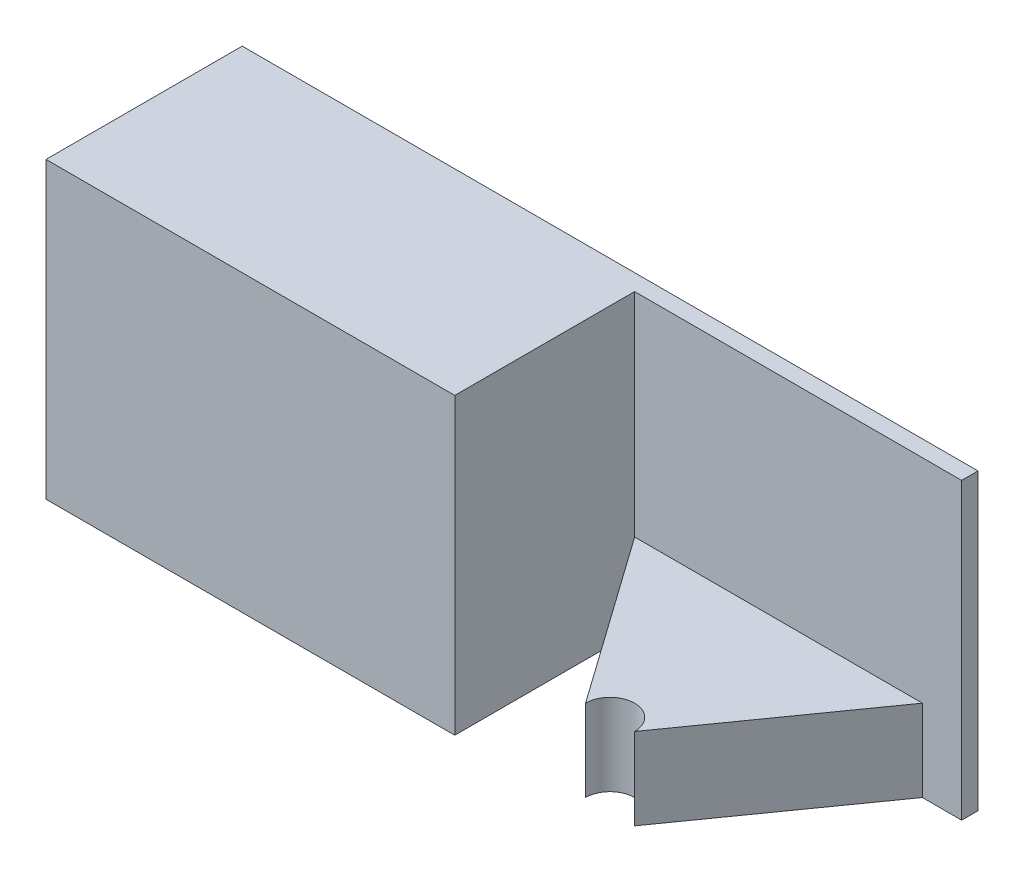
from build123d import *

# Parameters (mm, degrees)
SKETCH2_W           = 250
SKETCH2_H           = 120
BOSS_EXTRUDE1_DEPTH = 180
SKETCH3_W           = 450
SKETCH3_H           = 180
BOSS_EXTRUDE2_DEPTH = 10
BOSS_EXTRUDE3_DEPTH = 50


with BuildPart() as part:
    # Sketch2 → Boss-Extrude1 (new body)
    with BuildSketch(Plane(origin=(0, 0, 0), x_dir=(1, 0, 0), z_dir=(0, 1, 0))):
        Rectangle(SKETCH2_W, SKETCH2_H)
    extrude(amount=BOSS_EXTRUDE1_DEPTH)

    # Sketch3 → Boss-Extrude2 (add)
    with BuildSketch(Plane(origin=(0, 0, -60), x_dir=(-1, 0, 0), z_dir=(0, 0, -1))):
        with Locations((-100, 90)):
            Rectangle(SKETCH3_W, SKETCH3_H)
    extrude(amount=-BOSS_EXTRUDE2_DEPTH)

    # Sketch4 → Boss-Extrude3 (add)
    with BuildSketch(Plane.XZ):
        with BuildLine():
            Line((125, -50), (300.98, -50))
            Line((300.98, -50), (227.99, 53))
            ThreePointArc((227.99, 53), (212.99, 38), (197.99, 53))
            Line((197.99, 53), (125, -50))
        make_face()
    extrude(amount=-BOSS_EXTRUDE3_DEPTH)


solid = part.part
